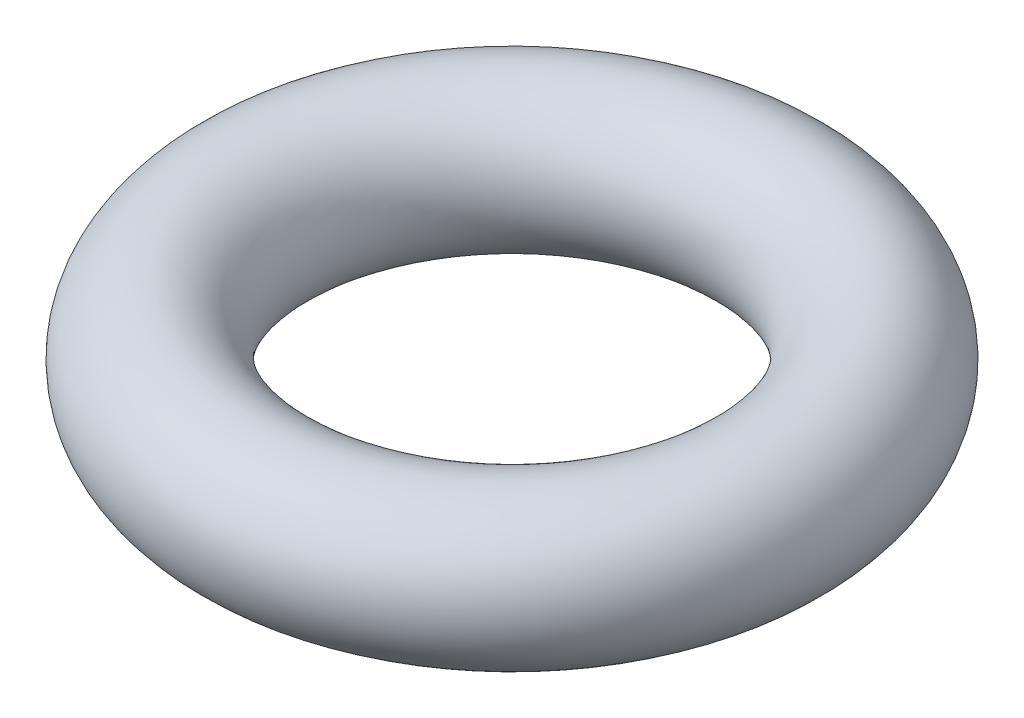
from build123d import *

# Parameters (mm, degrees)
SKETCH3_R = 1


with BuildPart() as part:
    # Sweep1: sweep along a path in Sketch1
    with BuildLine(Plane(origin=(0, 0, 0), x_dir=(1, 0, 0), z_dir=(0, 1, 0))) as sweep1_path:
        CenterArc((0, 0), 3.5, 0, 360)
    # Sketch3 → Sweep1 (sweep)
    with BuildSketch(Plane(origin=(0, 0, 0), x_dir=(0, 0, -1), z_dir=(1, 0, 0))):
        with Locations((-3.49106419, 0)):
            Circle(SKETCH3_R)
    sweep(path=sweep1_path.line)


solid = part.part
